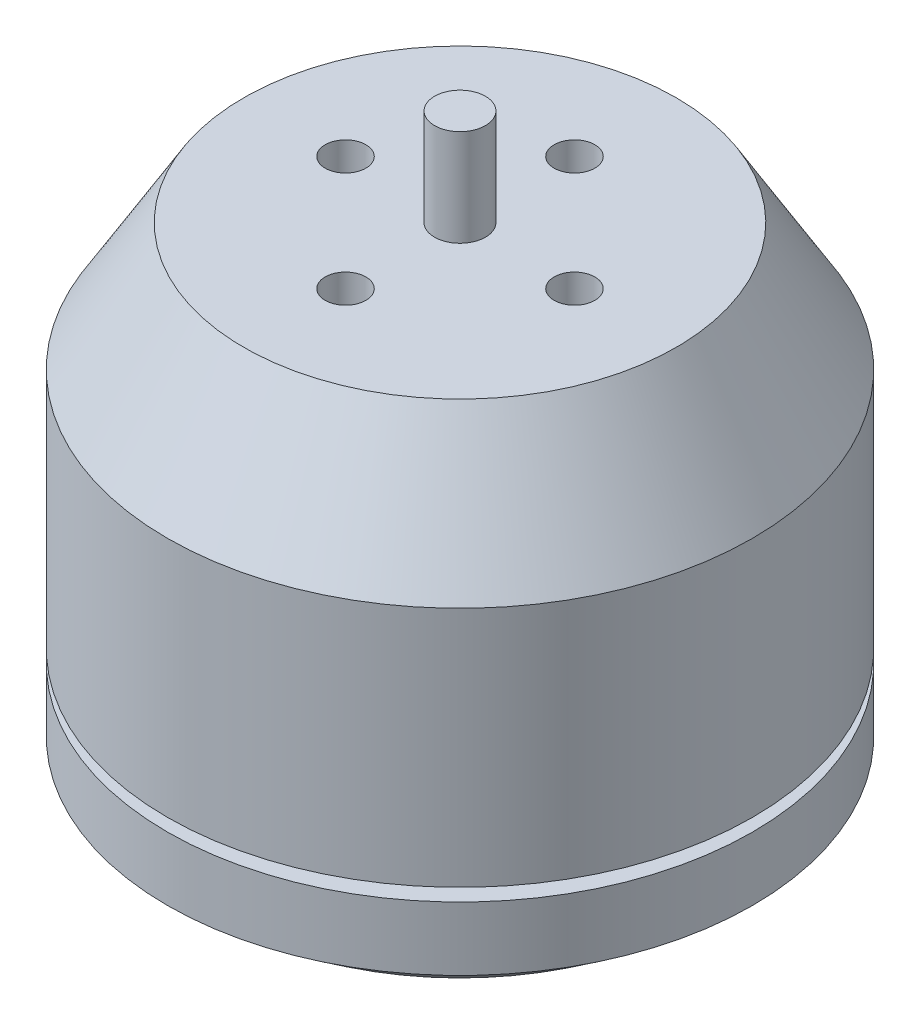
from build123d import *

# Parameters (mm, degrees)
M2_GEWINDEBOHRUNG1_D     = 1.6
M2_GEWINDEBOHRUNG1_DEPTH = 3
M2_GEWINDEBOHRUNG1_TIP   = 0.480688495
M2_GEWINDEBOHRUNG2_D     = 1.6
M2_GEWINDEBOHRUNG2_DEPTH = 5
M2_GEWINDEBOHRUNG2_TIP   = 0.480688495


with BuildPart() as part:
    # Skizze1 → Rotation1 (revolve)
    with BuildSketch(Plane.XY, mode=Mode.PRIVATE) as rotation1_sk:
        Polygon((9.5, 1), (3, 1), (3, 1.3), (1, 1.3), (1, 0), (0, 0), (0, 23.8), (1, 23.8), (1, 20), (8.5, 20), (11.5, 15), (11.5, 5.5), (10.5, 5.5), (10.5, 5), (11.5, 5), (11.5, 2.5), align=None)
    revolve(rotation1_sk.sketch.rotate(Axis((0, 0, 0), (0, 1, 0)), 90), axis=Axis((0, 0, 0), (0, 1, 0)))

    # M2 Gewindebohrung1
    with Locations(Plane(origin=(0, 20, 0), x_dir=(1, 0, 0), z_dir=(0, 1, 0))):
        with Locations((-4.5, 0), (0, 4.5), (4.5, 0), (0, -4.5)):
            Hole(M2_GEWINDEBOHRUNG1_D / 2, depth=M2_GEWINDEBOHRUNG1_DEPTH)
            with Locations((0, 0, -(M2_GEWINDEBOHRUNG1_DEPTH + M2_GEWINDEBOHRUNG1_TIP / 2))):  # 118° drill point
                Cone(0, M2_GEWINDEBOHRUNG1_D / 2, M2_GEWINDEBOHRUNG1_TIP, mode=Mode.SUBTRACT)

    # M2 Gewindebohrung2
    with Locations(Plane(origin=(0, 1, 0), x_dir=(-1, 0, 0), z_dir=(0, -1, 0))):
        with Locations((0, 8), (0, -8), (6, 0), (-6, 0)):
            Hole(M2_GEWINDEBOHRUNG2_D / 2, depth=M2_GEWINDEBOHRUNG2_DEPTH)
            with Locations((0, 0, -(M2_GEWINDEBOHRUNG2_DEPTH + M2_GEWINDEBOHRUNG2_TIP / 2))):  # 118° drill point
                Cone(0, M2_GEWINDEBOHRUNG2_D / 2, M2_GEWINDEBOHRUNG2_TIP, mode=Mode.SUBTRACT)


solid = part.part
